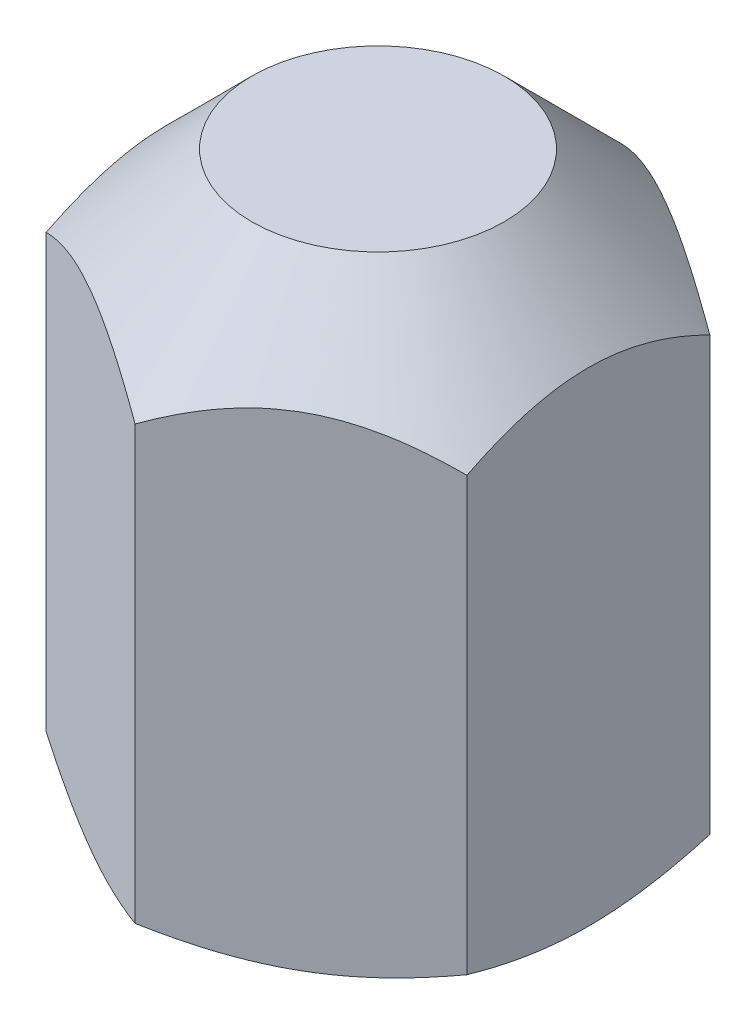
from build123d import *

# Parameters (mm, degrees)
VYSUNOUT1_DEPTH          = 13.5
SKICA4_R                 = 2.55
ODEBRAT_VYSUNUT_M1_DEPTH = 12.5
ZKOSIT1_SIZE             = 0.6
ZKOSIT1_SIZE2            = 0.346410162


with BuildPart() as part:
    # Skica1 → Vysunout1 (new body)
    with BuildSketch(Plane(origin=(0, 0, 0), x_dir=(1, 0, 0), z_dir=(0, 1, 0))):
        Polygon((5, -2.886751346), (5, 2.886751346), (0, 5.773502692), (-5, 2.886751346), (-5, -2.886751346), (0, -5.773502692), align=None)
    extrude(amount=VYSUNOUT1_DEPTH)

    # Skica2 → Odebrat otočením1 (revolve, cut)
    with BuildSketch(Plane(origin=(0, 0, 0), x_dir=(0, 0, -1), z_dir=(1, 0, 0)), mode=Mode.PRIVATE) as odebrat_oto_en_m1_sk:
        Polygon((-5.773502692, 13.5), (-5.773502692, 10.726497308), (-3, 13.5), align=None)
    revolve(odebrat_oto_en_m1_sk.sketch.rotate(Axis((0, 13.5, 0), (0, -1, 0)), 180), axis=Axis((0, 13.5, 0), (0, -1, 0)), mode=Mode.SUBTRACT)

    # Skica3 → Odebrat otočením2 (revolve, cut)
    with BuildSketch(Plane.XY):
        Polygon((5, 0), (28.382685902, 0), (28.382685902, 13.5), align=None)
    revolve(axis=Axis((0, 0, 0), (0, 1, 0)), mode=Mode.SUBTRACT)

    # Skica4 → Odebrat vysunutím1 (cut)
    with BuildSketch(Plane.XZ):
        with Locations(Location((0, 0, 0), (0, 0, 270))):
            Circle(SKICA4_R)
    extrude(amount=-ODEBRAT_VYSUNUT_M1_DEPTH, mode=Mode.SUBTRACT)

    # Zkosit1
    zkosit1_edges = [part.edges().sort_by_distance(p)[0] for p in [
        (0, 0, 2.55),
    ]]
    zkosit1_side = [part.faces().sort_by_distance(p)[0] for p in [
        (4.207652534, 0, 2.429289317),
    ]]
    chamfer(zkosit1_edges, length=ZKOSIT1_SIZE, length2=ZKOSIT1_SIZE2, reference=zkosit1_side[0])


solid = part.part
